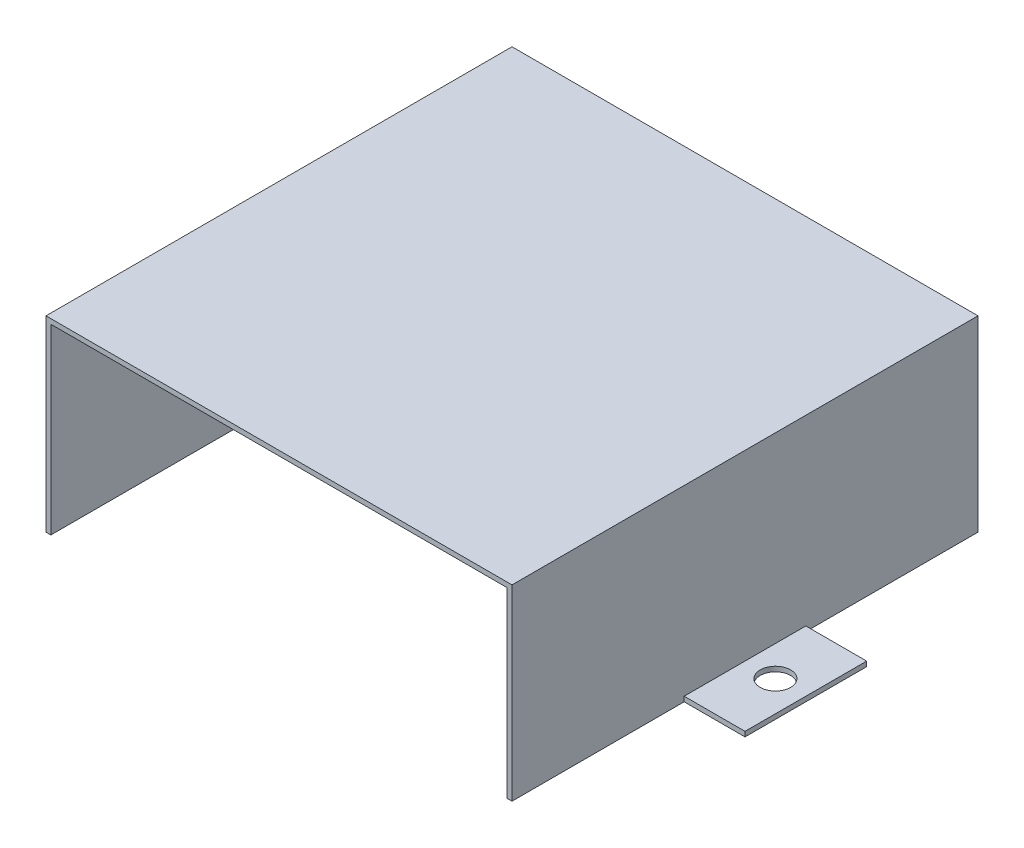
from build123d import *

# Parameters (mm, degrees)
SKETCH_1_W          = 75
SKETCH_1_H          = 75
EXTRUDE_1_DEPTH     = 0.8
SKETCH_2_W          = 76.6
SKETCH_2_H          = 76.6
SKETCH_2_W_2        = 75
SKETCH_2_H_2        = 75
EXTRUDE_2_DEPTH     = 30.8
EXTRUDE_3_DEPTH     = 0.8
F_5_0MM_1_D         = 5
SKETCH_8_W          = 75
SKETCH_8_H          = 30
CUT_EXTRUDE_1_DEPTH = 119.86631146


with BuildPart() as part:
    # 草图1 → 凸台-拉伸1 (new body)
    with BuildSketch(Plane(origin=(0, 0, 0), x_dir=(1, 0, 0), z_dir=(0, 1, 0))):
        with Locations((37.5, -37.5)):
            Rectangle(SKETCH_1_W, SKETCH_1_H)
    extrude(amount=EXTRUDE_1_DEPTH)

    # 草图2 → 凸台-拉伸2 (add)
    with BuildSketch(Plane(origin=(0, 0.8, 0), x_dir=(1, 0, 0), z_dir=(0, 1, 0))):
        with Locations((37.5, -37.5)):
            Rectangle(SKETCH_2_W, SKETCH_2_H)
        with Locations((37.5, -37.5)):
            Rectangle(SKETCH_2_W_2, SKETCH_2_H_2, mode=Mode.SUBTRACT)
    extrude(amount=-EXTRUDE_2_DEPTH)

    # 草图3 → 凸台-拉伸3 (add)
    with BuildSketch(Plane.XZ.offset(30)):
        Polygon((-0.8, 37.5), (-0.8, 47.5), (-10.8, 47.5), (-10.8, 27.5), (-0.8, 27.5), align=None)
        Polygon((75.8, 27.5), (75.8, 37.5), (75.8, 47.5), (85.8, 47.5), (85.8, 27.5), align=None)
    extrude(amount=-EXTRUDE_3_DEPTH)

    # Ø5.0mm 暗销孔1 (through all)
    with Locations(Plane(origin=(0, -30, 0), x_dir=(-1, 0, 0), z_dir=(0, -1, 0))):
        with Locations((5.8, -37.5), (-80.8, -37.5)):
            Hole(F_5_0MM_1_D / 2)

    # 草图8 → 切除-拉伸1 (cut, through all)
    with BuildSketch(Plane(origin=(0, 0, -0.8), x_dir=(-1, 0, 0), z_dir=(0, 0, -1))):
        with Locations((-37.5, -15)):
            Rectangle(SKETCH_8_W, SKETCH_8_H)
    extrude(amount=-CUT_EXTRUDE_1_DEPTH, mode=Mode.SUBTRACT)


solid = part.part
